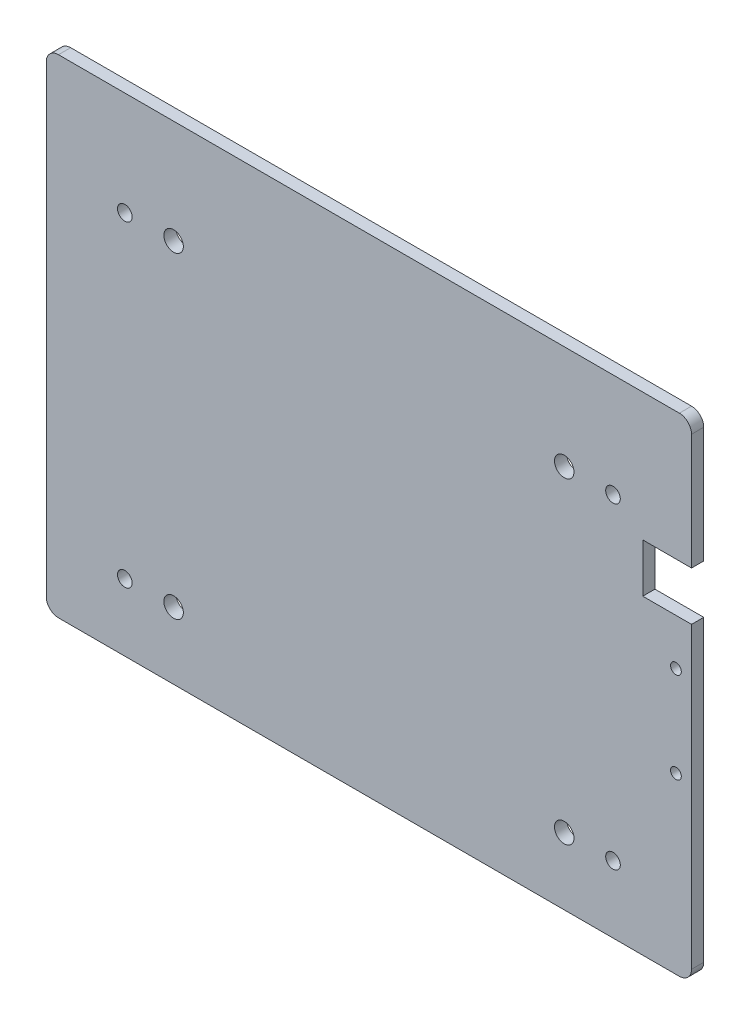
from build123d import *

# Parameters (mm, degrees)
ESQUISSE1_W             = 295
ESQUISSE1_H             = 260
BOSS_EXTRU_1_DEPTH      = 5
ESQUISSE3_OUTSIDE_W     = 375.652
ESQUISSE3_OUTSIDE_H     = 340.652
ESQUISSE3_OUTSIDE_W_2   = 264.6
ESQUISSE3_OUTSIDE_H_2   = 200
ENL_V_MAT_EXTRU_2_DEPTH = 394.255642045
CONG_1_R                = 5
ESQUISSE4_R             = 3
ENL_V_MAT_EXTRU_3_DEPTH = 363.233405417
ESQUISSE5_R             = 4
ENL_V_MAT_EXTRU_4_DEPTH = 363.233405417
ESQUISSE8_R             = 2.2
ENL_V_MAT_EXTRU_7_DEPTH = 363.233405417
ESQUISSE9_W             = 20
ESQUISSE9_H             = 20
ENL_V_MAT_EXTRU_8_DEPTH = 363.233405417


with BuildPart() as part:
    # Esquisse1 → Boss.-Extru.1 (new body)
    with BuildSketch(Plane.XY):
        with Locations((-147.5, -130)):
            Rectangle(ESQUISSE1_W, ESQUISSE1_H)
    extrude(amount=BOSS_EXTRU_1_DEPTH)

    # Esquisse3 outside → Enlèv. mat.-Extru.2 (cut, through all)
    with BuildSketch(Plane(origin=(0, 0, 0), x_dir=(-1, 0, 0), z_dir=(0, 0, -1))):
        with Locations((147.5, -130)):
            Rectangle(ESQUISSE3_OUTSIDE_W, ESQUISSE3_OUTSIDE_H)
        with Locations((147.5, -130)):
            Rectangle(ESQUISSE3_OUTSIDE_W_2, ESQUISSE3_OUTSIDE_H_2, mode=Mode.SUBTRACT)
    extrude(amount=-ENL_V_MAT_EXTRU_2_DEPTH, mode=Mode.SUBTRACT)

    # Congé1
    cong_1_edges = [part.edges().sort_by_distance(p)[0] for p in [
        (-279.8, -30, 2.5),
        (-15.2, -30, 2.5),
        (-279.8, -230, 2.5),
        (-15.2, -230, 2.5),
    ]]
    fillet(cong_1_edges, radius=CONG_1_R)

    # Esquisse4 → Enlèv. mat.-Extru.3 (cut, through all)
    with BuildSketch(Plane(origin=(0, 0, 0), x_dir=(-1, 0, 0), z_dir=(0, 0, -1))):
        with Locations((47.409458813, -72.530608435)):
            Circle(ESQUISSE4_R)
        with Locations((47.409458813, -202.530608435)):
            Circle(ESQUISSE4_R)
        with Locations((247.590541187, -202.530608435)):
            Circle(ESQUISSE4_R)
        with Locations((247.590541187, -72.530608435)):
            Circle(ESQUISSE4_R)
    extrude(amount=-ENL_V_MAT_EXTRU_3_DEPTH, mode=Mode.SUBTRACT)

    # Esquisse5 → Enlèv. mat.-Extru.4 (cut, through all)
    with BuildSketch(Plane.XY.offset(5)):
        with Locations((-227.590541187, -202.530608435)):
            Circle(ESQUISSE5_R)
        with Locations((-67.409458813, -202.530608435)):
            Circle(ESQUISSE5_R)
        with Locations((-227.590541187, -72.530608435)):
            Circle(ESQUISSE5_R)
        with Locations((-67.409458813, -72.530608435)):
            Circle(ESQUISSE5_R)
    extrude(amount=-ENL_V_MAT_EXTRU_4_DEPTH, mode=Mode.SUBTRACT)

    # Esquisse8 → Enlèv. mat.-Extru.7 (cut, through all)
    with BuildSketch(Plane.XY.offset(5)):
        with Locations((-21.6, -158.6)):
            Circle(ESQUISSE8_R)
        with Locations((-21.6, -121.4)):
            Circle(ESQUISSE8_R)
    extrude(amount=-ENL_V_MAT_EXTRU_7_DEPTH, mode=Mode.SUBTRACT)

    # Esquisse9 → Enlèv. mat.-Extru.8 (cut, through all)
    with BuildSketch(Plane.XY.offset(5)):
        with Locations((-25.2, -92.5)):
            Rectangle(ESQUISSE9_W, ESQUISSE9_H)
    extrude(amount=-ENL_V_MAT_EXTRU_8_DEPTH, mode=Mode.SUBTRACT)


solid = part.part
